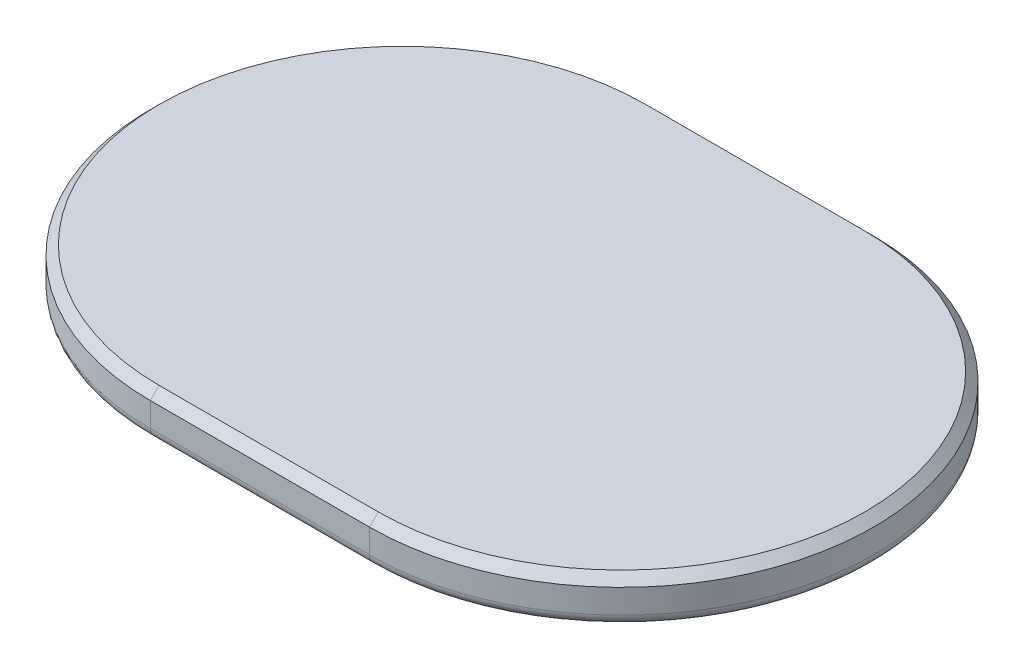
from build123d import *

# Parameters (mm, degrees)
BOSS_EXTRUDE1_DEPTH = 4
CHAMFER1_SIZE       = 0.8
FILLET1_R           = 1


with BuildPart() as part:
    # Sketch1 → Boss-Extrude1 (new body)
    with BuildSketch(Plane(origin=(0, 0, 0), x_dir=(1, 0, 0), z_dir=(0, 1, 0))):
        with BuildLine():
            Line((-10, 23), (10, 23))
            ThreePointArc((10, 23), (33, 0), (10, -23))
            Line((10, -23), (-10, -23))
            ThreePointArc((-10, -23), (-33, 0), (-10, 23))
        make_face()
    extrude(amount=BOSS_EXTRUDE1_DEPTH)

    # Chamfer1
    chamfer1_edges = [part.edges().sort_by_distance(p)[0] for p in [
        (33, 4, 0),
        (0, 4, -23),
        (-33, 4, 0),
        (0, 4, 23),
    ]]
    chamfer(chamfer1_edges, length=CHAMFER1_SIZE)

    # Fillet1
    fillet1_edges = [part.edges().sort_by_distance(p)[0] for p in [
        (0, 0, -23),
        (33, 0, 0),
        (0, 0, 23),
        (-33, 0, 0),
    ]]
    fillet(fillet1_edges, radius=FILLET1_R)


solid = part.part
